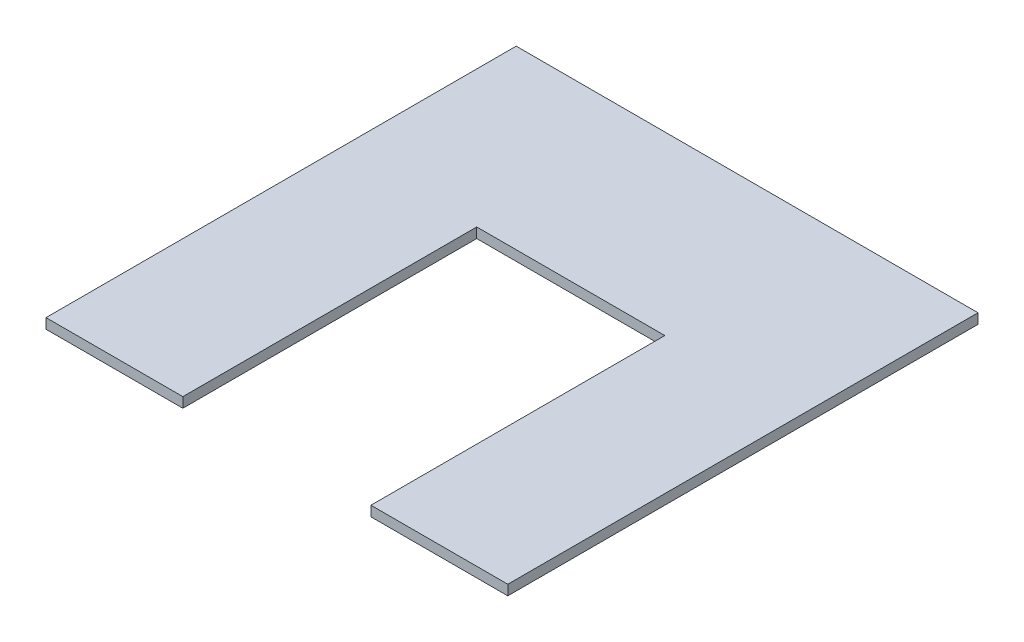
from build123d import *

# Parameters (mm, degrees)
BOSS_EXTRUDE1_DEPTH = 6


with BuildPart() as part:
    # Sketch2 → Boss-Extrude1 (new body)
    with BuildSketch(Plane(origin=(0, 0, 0), x_dir=(1, 0, 0), z_dir=(0, 1, 0))):
        Polygon((-41.523965694, 0), (233.476034306, 0), (233.476034306, -280), (151.976034306, -280), (151.976034306, -105), (39.976034306, -105), (39.976034306, -280), (-41.523965694, -280), align=None)
    extrude(amount=BOSS_EXTRUDE1_DEPTH)


solid = part.part
